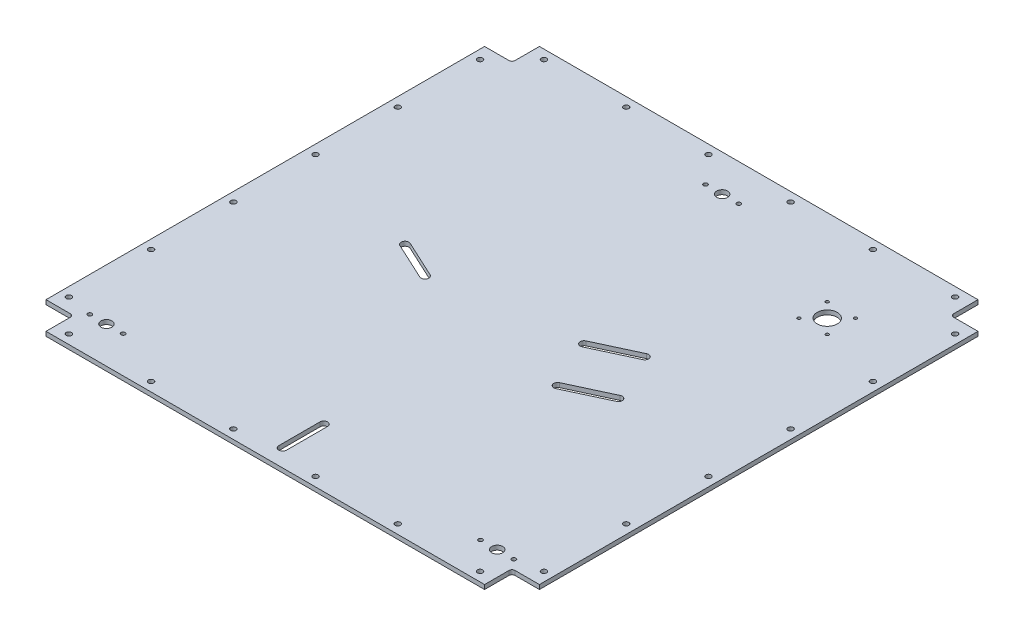
from build123d import *

# Parameters (mm, degrees)
SKETCH2_W             = 540
SKETCH2_H             = 540
SKETCH2_R             = 6
SKETCH2_R_2           = 11
BOSS_EXTRUDE1_DEPTH   = 4.7625
M4_CLEARANCE_HOLE1_D  = 4.5
M3_CLEARANCE_HOLE10_D = 3.4
SKETCH5_W             = 30
SKETCH5_H             = 30
CUT_EXTRUDE1_DEPTH    = 764.6901737
FILLET1_R             = 3.175
CUT_EXTRUDE2_DEPTH    = 764.6901737
CUT_EXTRUDE3_DEPTH    = 764.6901737
M5_CLEARANCE_HOLE1_D  = 5.8
LPATTERN1_COUNT       = 6
LPATTERN1_PITCH       = 90
M5_CLEARANCE_HOLE2_D  = 5.8
LPATTERN2_COUNT       = 6
LPATTERN2_PITCH       = 90
M5_CLEARANCE_HOLE3_D  = 5.8
LPATTERN3_COUNT       = 6
LPATTERN3_PITCH       = 90
M5_CLEARANCE_HOLE4_D  = 5.8
LPATTERN4_COUNT       = 6
LPATTERN4_PITCH       = 90


with BuildPart() as part:
    # Sketch2 → Boss-Extrude1 (new body)
    with BuildSketch(Plane(origin=(0, 0, 0), x_dir=(1, 0, 0), z_dir=(0, 1, 0))):
        with Locations((270, 270)):
            Rectangle(SKETCH2_W, SKETCH2_H)
        with Locations((56.175, 40)):
            Circle(SKETCH2_R, mode=Mode.SUBTRACT)
        with Locations((483.825, 40)):
            Circle(SKETCH2_R, mode=Mode.SUBTRACT)
        with Locations((270, 500)):
            Circle(SKETCH2_R, mode=Mode.SUBTRACT)
        with Locations((445, 440)):
            Circle(SKETCH2_R_2, mode=Mode.SUBTRACT)
    extrude(amount=BOSS_EXTRUDE1_DEPTH)

    # M4 Clearance Hole1 (through all)
    with Locations(Plane(origin=(74.425, 4.7625, -40), x_dir=(0, 0, 1), z_dir=(0, 1, 0))):
        with Locations((0, 0), (0, -36.5), (-460, 177.325), (-460, 213.825), (0, 391.15), (0, 427.65)):
            Hole(M4_CLEARANCE_HOLE1_D / 2)

    # M3 Clearance Hole10 (through all)
    with Locations(Plane(origin=(429.5, 4.7625, -455.5), x_dir=(0, 0, 1), z_dir=(0, 1, 0))):
        with Locations((0, 0), (0, 31), (31, 31), (31, 0)):
            Hole(M3_CLEARANCE_HOLE10_D / 2)

    # Sketch5 → Cut-Extrude1 (cut, through all)
    with BuildSketch(Plane(origin=(0, 4.7625, 0), x_dir=(1, 0, 0), z_dir=(0, 1, 0))):
        with Locations((15, 15)):
            Rectangle(SKETCH5_W, SKETCH5_H)
        with Locations((525, 15)):
            Rectangle(SKETCH5_W, SKETCH5_H)
        with Locations((525, 525)):
            Rectangle(SKETCH5_W, SKETCH5_H)
        with Locations((15, 525)):
            Rectangle(SKETCH5_W, SKETCH5_H)
    extrude(amount=-CUT_EXTRUDE1_DEPTH, mode=Mode.SUBTRACT)

    # Fillet1
    fillet1_edges = [part.edges().sort_by_distance(p)[0] for p in [
        (30, 2.38125, -510),
        (510, 2.38125, -510),
        (510, 2.38125, -30),
        (30, 2.38125, -30),
    ]]
    fillet(fillet1_edges, radius=FILLET1_R)

    # Sketch6 → Cut-Extrude2 (cut, through all)
    with BuildSketch(Plane(origin=(0, 4.7625, 0), x_dir=(1, 0, 0), z_dir=(0, 1, 0))):
        with BuildLine():
            Line((379.893699129, 307.475094097), (334.552801834, 286.398969393))
            ThreePointArc((334.552801834, 286.398969393), (332.490296164, 280.753522523), (338.135743034, 278.691016853))
            Line((338.135743034, 278.691016853), (383.476640328, 299.767141557))
            ThreePointArc((383.476640328, 299.767141557), (385.539145999, 305.412588427), (379.893699129, 307.475094097))
        make_face()
        with BuildLine():
            Line((405.008613589, 253.445580936), (359.667716294, 232.369456232))
            ThreePointArc((359.667716294, 232.369456232), (357.605210624, 226.724009362), (363.250657494, 224.661503692))
            Line((363.250657494, 224.661503692), (408.591554788, 245.737628396))
            ThreePointArc((408.591554788, 245.737628396), (410.654060459, 251.383075266), (405.008613589, 253.445580936))
        make_face()
    extrude(amount=-CUT_EXTRUDE2_DEPTH, mode=Mode.SUBTRACT)

    # Sketch9 → Cut-Extrude3 (cut, through all)
    with BuildSketch(Plane(origin=(0, 4.7625, 0), x_dir=(1, 0, 0), z_dir=(0, 1, 0))):
        with BuildLine():
            Line((274.25, 19), (274.25, 64))
            ThreePointArc((274.25, 64), (270, 68.25), (265.75, 64))
            Line((265.75, 64), (265.75, 19))
            ThreePointArc((265.75, 19), (270, 14.75), (274.25, 19))
        make_face()
        with BuildLine():
            Line((186.642601301, 263.737436412), (145.835793736, 282.705948646))
            ThreePointArc((145.835793736, 282.705948646), (140.190346866, 280.643442976), (142.252852537, 274.997996106))
            Line((142.252852537, 274.997996106), (183.059660101, 256.029483872))
            ThreePointArc((183.059660101, 256.029483872), (188.705106971, 258.091989542), (186.642601301, 263.737436412))
        make_face()
    extrude(amount=-CUT_EXTRUDE3_DEPTH, mode=Mode.SUBTRACT)

    # M5 Clearance Hole1 (through all)
    with Locations(Plane(origin=(45, 4.7625, -10), x_dir=(0, 0, 1), z_dir=(0, 1, 0))):
        with Locations((0, 0)):
            m5_clearance_hole1 = Hole(M5_CLEARANCE_HOLE1_D / 2)

    # LPattern1: M5 Clearance Hole1 ×6
    with Locations(*[(i * LPATTERN1_PITCH, 0, 0) for i in range(1, LPATTERN1_COUNT)]):
        add(m5_clearance_hole1, mode=Mode.SUBTRACT)

    # M5 Clearance Hole2 (through all)
    with Locations(Plane(origin=(10, 4.7625, -495), x_dir=(0, 0, 1), z_dir=(0, 1, 0))):
        with Locations((0, 0)):
            m5_clearance_hole2 = Hole(M5_CLEARANCE_HOLE2_D / 2)

    # LPattern2: M5 Clearance Hole2 ×6
    with Locations(*[(0, 0, i * LPATTERN2_PITCH) for i in range(1, LPATTERN2_COUNT)]):
        add(m5_clearance_hole2, mode=Mode.SUBTRACT)

    # M5 Clearance Hole3 (through all)
    with Locations(Plane(origin=(495, 4.7625, -530), x_dir=(0, 0, 1), z_dir=(0, 1, 0))):
        with Locations((0, 0)):
            m5_clearance_hole3 = Hole(M5_CLEARANCE_HOLE3_D / 2)

    # LPattern3: M5 Clearance Hole3 ×6
    with Locations(*[(-i * LPATTERN3_PITCH, 0, 0) for i in range(1, LPATTERN3_COUNT)]):
        add(m5_clearance_hole3, mode=Mode.SUBTRACT)

    # M5 Clearance Hole4 (through all)
    with Locations(Plane(origin=(530, 4.7625, -45), x_dir=(0, 0, 1), z_dir=(0, 1, 0))):
        with Locations((0, 0)):
            m5_clearance_hole4 = Hole(M5_CLEARANCE_HOLE4_D / 2)

    # LPattern4: M5 Clearance Hole4 ×6
    with Locations(*[(0, 0, -i * LPATTERN4_PITCH) for i in range(1, LPATTERN4_COUNT)]):
        add(m5_clearance_hole4, mode=Mode.SUBTRACT)


solid = part.part
